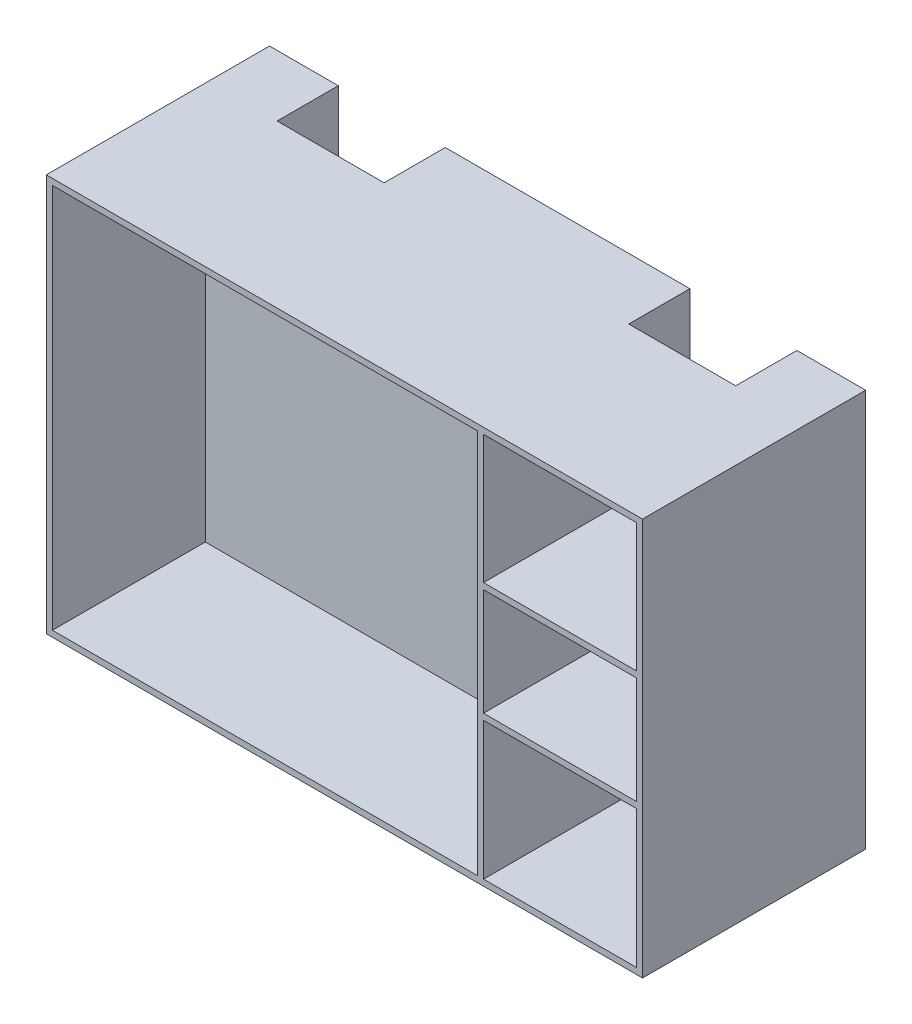
from build123d import *

# Parameters (mm, degrees)
SKIZZE1_W                       = 195
SKIZZE1_H                       = 130
AUFSATZ_LINEAR_AUSTRAGEN1_DEPTH = 53
SKIZZE2_W                       = 139
SKIZZE2_H                       = 126
SCHNITT_LINEAR_AUSTRAGEN1_DEPTH = 50
SKIZZE3_W                       = 50
SKIZZE3_H                       = 42
SCHNITT_LINEAR_AUSTRAGEN2_DEPTH = 50
SKIZZE4_W                       = 50
SKIZZE4_H                       = 45
SCHNITT_LINEAR_AUSTRAGEN3_DEPTH = 50
SKIZZE5_W                       = 50
SKIZZE5_H                       = 35
SCHNITT_LINEAR_AUSTRAGEN4_DEPTH = 50
SKIZZE6_W                       = 195
SKIZZE6_H                       = 130
AUFSATZ_LINEAR_AUSTRAGEN2_DEPTH = 20
SKIZZE7_W                       = 35
SKIZZE7_H                       = 130
SCHNITT_LINEAR_AUSTRAGEN5_DEPTH = 20


with BuildPart() as part:
    # Skizze1 → Aufsatz-Linear austragen1 (new body)
    with BuildSketch(Plane(origin=(0, 0, -3), x_dir=(-1, 0, 0), z_dir=(0, 0, -1))):
        with Locations((-28.307004173, -3.528995936)):
            Rectangle(SKIZZE1_W, SKIZZE1_H)
    extrude(amount=-AUFSATZ_LINEAR_AUSTRAGEN1_DEPTH)

    # Skizze2 → Schnitt-Linear austragen1 (cut)
    with BuildSketch(Plane.XY.offset(50)):
        with Locations((2.307004173, -3.528995936)):
            Rectangle(SKIZZE2_W, SKIZZE2_H)
    extrude(amount=-SCHNITT_LINEAR_AUSTRAGEN1_DEPTH, mode=Mode.SUBTRACT)

    # Skizze3 → Schnitt-Linear austragen2 (cut)
    with BuildSketch(Plane.XY.offset(50)):
        with Locations((98.807004173, 38.471004064)):
            Rectangle(SKIZZE3_W, SKIZZE3_H)
    extrude(amount=-SCHNITT_LINEAR_AUSTRAGEN2_DEPTH, mode=Mode.SUBTRACT)

    # Skizze4 → Schnitt-Linear austragen3 (cut)
    with BuildSketch(Plane.XY.offset(50)):
        with Locations((98.807004173, -44.028995936)):
            Rectangle(SKIZZE4_W, SKIZZE4_H)
    extrude(amount=-SCHNITT_LINEAR_AUSTRAGEN3_DEPTH, mode=Mode.SUBTRACT)

    # Skizze5 → Schnitt-Linear austragen4 (cut)
    with BuildSketch(Plane.XY.offset(50)):
        with Locations((98.807004173, -2.028995936)):
            Rectangle(SKIZZE5_W, SKIZZE5_H)
    extrude(amount=-SCHNITT_LINEAR_AUSTRAGEN4_DEPTH, mode=Mode.SUBTRACT)

    # Skizze6 → Aufsatz-Linear austragen2 (add)
    with BuildSketch(Plane(origin=(0, 0, -3), x_dir=(-1, 0, 0), z_dir=(0, 0, -1))):
        with Locations((-28.307004173, -3.528995936)):
            Rectangle(SKIZZE6_W, SKIZZE6_H)
    extrude(amount=AUFSATZ_LINEAR_AUSTRAGEN2_DEPTH)

    # Skizze7 → Schnitt-Linear austragen5 (cut)
    with BuildSketch(Plane(origin=(0, 0, -23), x_dir=(-1, 0, 0), z_dir=(0, 0, -1))):
        with Locations((-85.807004173, -3.528995936)):
            Rectangle(SKIZZE7_W, SKIZZE7_H)
        with Locations((29.192995827, -3.528995936)):
            Rectangle(SKIZZE7_W, SKIZZE7_H)
    extrude(amount=-SCHNITT_LINEAR_AUSTRAGEN5_DEPTH, mode=Mode.SUBTRACT)


solid = part.part
